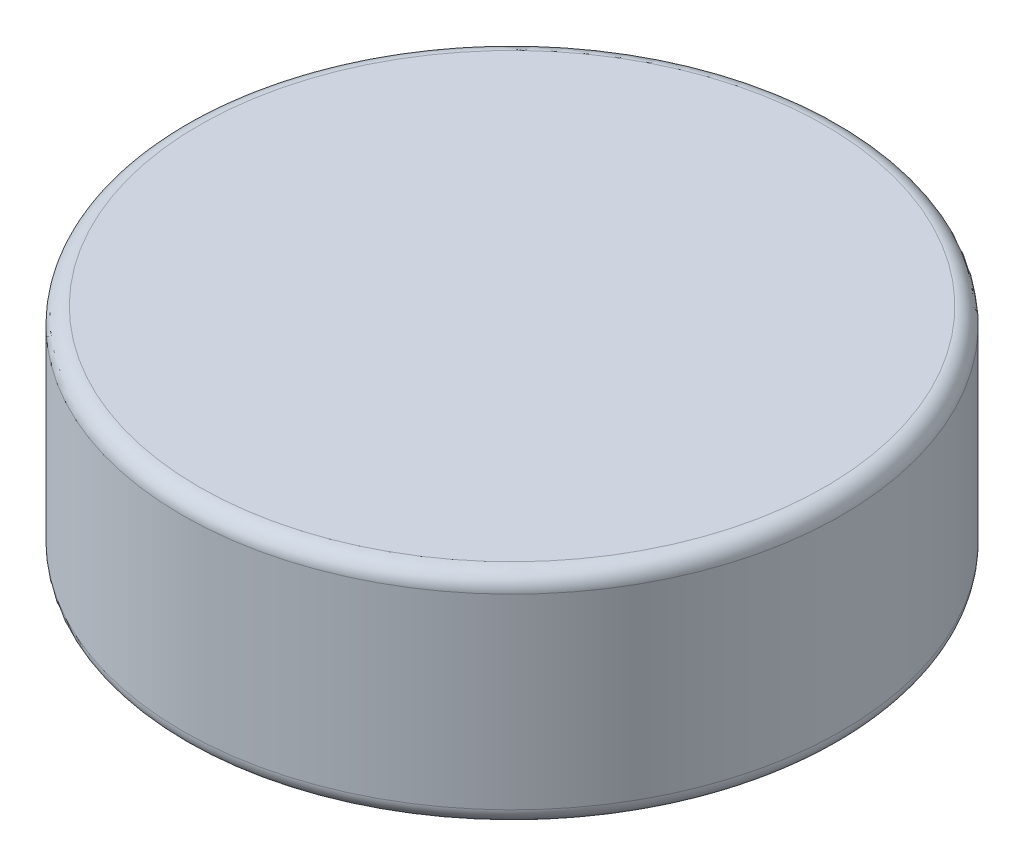
from build123d import *

# Parameters (mm, degrees)
SKIZZE1_R                       = 3
AUFSATZ_LINEAR_AUSTRAGEN1_DEPTH = 2
VERRUNDUNG1_R                   = 0.15


with BuildPart() as part:
    # Skizze1 → Aufsatz-Linear austragen1 (new body)
    with BuildSketch(Plane(origin=(0, 0, 0), x_dir=(1, 0, 0), z_dir=(0, 1, 0))):
        with Locations(Location((0, 0, 0), (0, 0, 270))):
            Circle(SKIZZE1_R)
    extrude(amount=AUFSATZ_LINEAR_AUSTRAGEN1_DEPTH)

    # Verrundung1
    verrundung1_edges = [part.edges().sort_by_distance(p)[0] for p in [
        (0, 0, -3),
        (0, 2, -3),
    ]]
    fillet(verrundung1_edges, radius=VERRUNDUNG1_R)


solid = part.part
